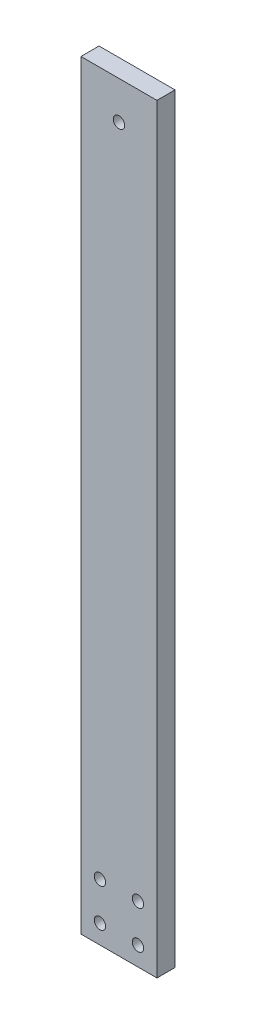
from build123d import *

# Parameters (mm, degrees)
SKETCH1_W           = 20
SKETCH1_H           = 200
BOSS_EXTRUDE1_DEPTH = 4.7625
SKETCH2_R           = 1.5
CUT_EXTRUDE1_DEPTH  = 101.611537143
SKETCH3_R           = 1.5
CUT_EXTRUDE2_DEPTH  = 101.611537143


with BuildPart() as part:
    # Sketch1 → Boss-Extrude1 (new body)
    with BuildSketch(Plane.XY):
        Rectangle(SKETCH1_W, SKETCH1_H)
    extrude(amount=BOSS_EXTRUDE1_DEPTH)

    # Sketch2 → Cut-Extrude1 (cut, through all)
    with BuildSketch(Plane.XY.offset(4.7625)):
        with Locations((-5, -95)):
            Circle(SKETCH2_R)
        with Locations((5, -95)):
            Circle(SKETCH2_R)
        with Locations((-5, -85)):
            Circle(SKETCH2_R)
        with Locations((5, -85)):
            Circle(SKETCH2_R)
    extrude(amount=-CUT_EXTRUDE1_DEPTH, mode=Mode.SUBTRACT)

    # Sketch3 → Cut-Extrude2 (cut, through all)
    with BuildSketch(Plane.XY.offset(4.7625)):
        with Locations((0, 90)):
            Circle(SKETCH3_R)
    extrude(amount=-CUT_EXTRUDE2_DEPTH, mode=Mode.SUBTRACT)


solid = part.part
